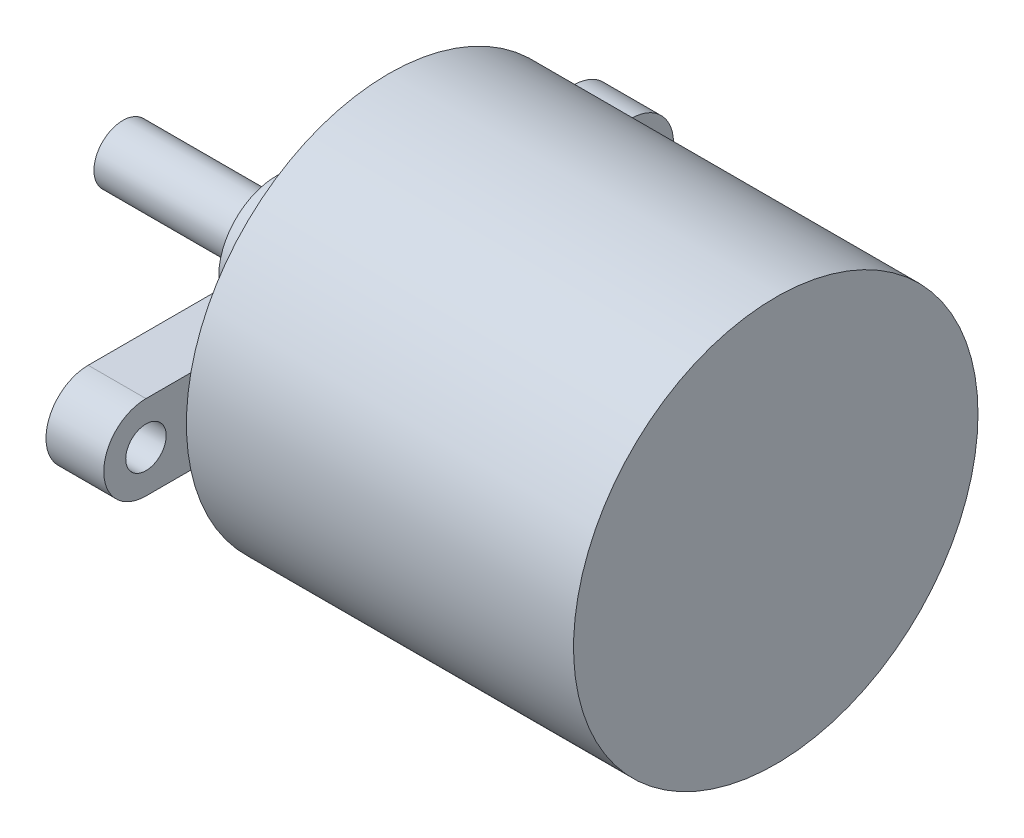
from build123d import *

# Parameters (mm, degrees)
SKETCH1_R                      = 17.5
BOSS_EXTRUDE1_DEPTH            = 33.5
BOSS_EXTRUDE2_DEPTH            = 5
F_3_5_3_5_DIAMETER_HOLE1_D     = 3.5
F_3_5_3_5_DIAMETER_HOLE1_DEPTH = 70
F_3_5_3_5_DIAMETER_HOLE1_TIP   = 1.051506083
SKETCH5_R                      = 5
BOSS_EXTRUDE3_DEPTH            = 4.7
SKETCH6_R                      = 2.5
BOSS_EXTRUDE4_DEPTH            = 13.3


with BuildPart() as part:
    # Sketch1 → Boss-Extrude1 (new body)
    with BuildSketch(Plane(origin=(0, 0, 0), x_dir=(0, 0, -1), z_dir=(1, 0, 0))):
        Circle(SKETCH1_R)
    extrude(amount=BOSS_EXTRUDE1_DEPTH)

    # Sketch2 → Boss-Extrude2 (add)
    with BuildSketch(Plane.ZY):
        with BuildLine():
            Line((-21, 3.65), (21, 3.65))
            ThreePointArc((21, 3.65), (24.65, 0), (21, -3.65))
            Line((21, -3.65), (-21, -3.65))
            ThreePointArc((-21, -3.65), (-24.65, 0), (-21, 3.65))
        make_face()
    extrude(amount=BOSS_EXTRUDE2_DEPTH)

    # Ø3.5 (3.5) Diameter Hole1
    with Locations(Plane.ZY.offset(5)):
        with Locations((-21, -0.140336266), (21, 0)):
            Hole(F_3_5_3_5_DIAMETER_HOLE1_D / 2, depth=F_3_5_3_5_DIAMETER_HOLE1_DEPTH)
            with Locations((0, 0, -(F_3_5_3_5_DIAMETER_HOLE1_DEPTH + F_3_5_3_5_DIAMETER_HOLE1_TIP / 2))):  # 118° drill point
                Cone(0, F_3_5_3_5_DIAMETER_HOLE1_D / 2, F_3_5_3_5_DIAMETER_HOLE1_TIP, mode=Mode.SUBTRACT)

    # Sketch5 → Boss-Extrude3 (add)
    with BuildSketch(Plane.ZY.offset(5)):
        with Locations(Location((0, 0, 0), (0, 0, 226.886394054))):
            Circle(SKETCH5_R)
    extrude(amount=BOSS_EXTRUDE3_DEPTH)

    # Sketch6 → Boss-Extrude4 (add)
    with BuildSketch(Plane.ZY.offset(9.7)):
        Circle(SKETCH6_R)
    extrude(amount=BOSS_EXTRUDE4_DEPTH)


solid = part.part
